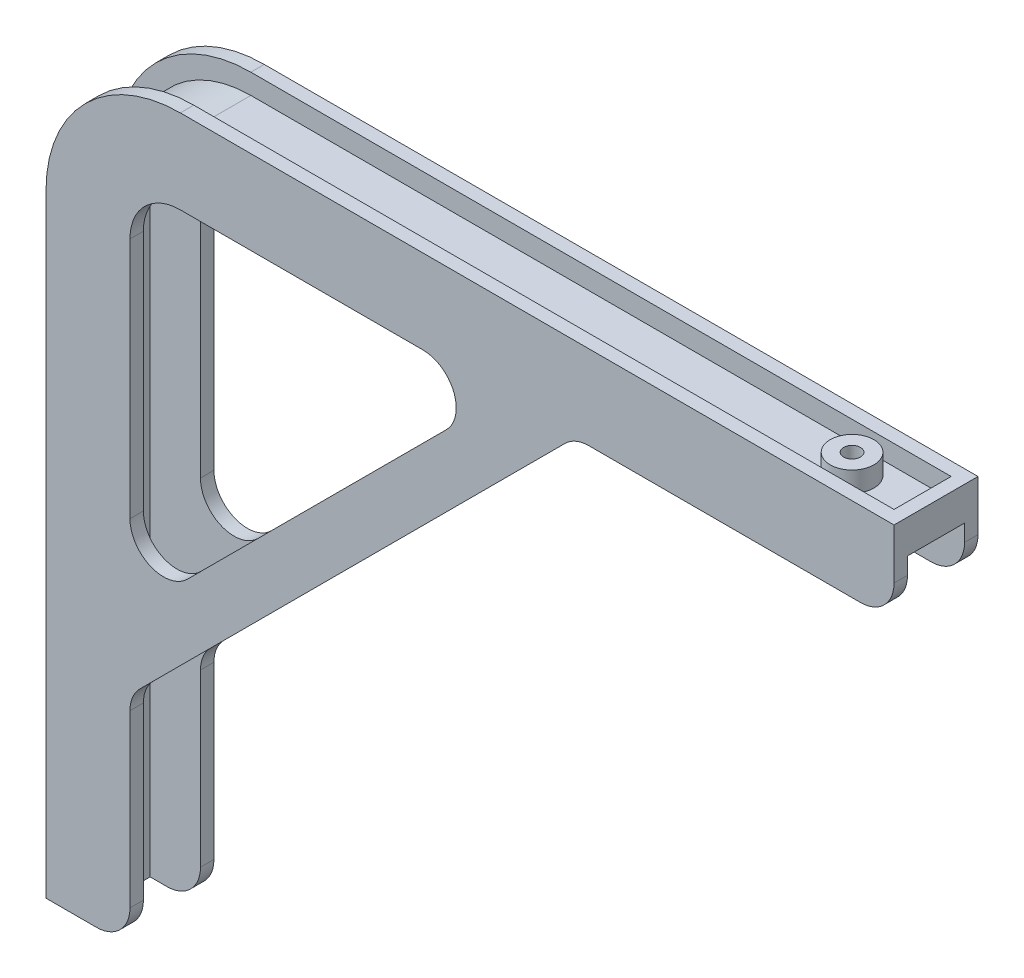
from build123d import *

# Parameters (mm, degrees)
EXTRUSION1_DEPTH        = 12.5
ESQUISSE2_R             = 3
ENL_V_MAT_EXTRU_1_DEPTH = 323.674371464
ESQUISSE3_R             = 2.5
ENL_V_MAT_EXTRU_2_DEPTH = 331.255582845
COQUE1_T                = -4
EXTRUSION2_DEPTH        = 4


with BuildPart() as part:
    # Esquisse1 → Extrusion1 (new, symmetric)
    with BuildSketch(Plane.XY):
        with BuildLine():
            Line((0, 0), (-212.5, 0))
            ThreePointArc((-212.5, 0), (-233.713203436, -8.786796564), (-242.5, -30))
            Line((-242.5, -30), (-242.5, -212.5))
            Line((-242.5, -212.5), (-252.5, -212.5))
            Line((-252.5, -212.5), (-252.5, -30))
            ThreePointArc((-252.5, -30), (-240.784271247, -1.715728753), (-212.5, 10))
            Line((-212.5, 10), (0, 10))
            Line((0, 10), (0, 0))
        make_face()
    extrude(amount=EXTRUSION1_DEPTH, both=True)

    # Esquisse2 → Enlèv. mat.-Extru.1 (cut, through all)
    with BuildSketch(Plane(origin=(-242.5, 0, 0), x_dir=(0, 0, -1), z_dir=(1, 0, 0))):
        with Locations(Location((0, -50, 0), (0, 0, 90))):
            Circle(ESQUISSE2_R)
        with Locations(Location((0, -175, 0), (0, 0, 90))):
            Circle(ESQUISSE2_R)
    extrude(amount=-ENL_V_MAT_EXTRU_1_DEPTH, mode=Mode.SUBTRACT)

    # Esquisse3 → Enlèv. mat.-Extru.2 (cut, through all)
    with BuildSketch(Plane.XZ):
        with Locations((-25, 0)):
            Circle(ESQUISSE3_R)
    extrude(amount=-ENL_V_MAT_EXTRU_2_DEPTH, mode=Mode.SUBTRACT)

    # Coque1
    coque1_openings = [part.faces().sort_by_distance(p)[0] for p in [
        (-252.5, -121.359810516, 0),
        (-240.784271247, -1.715728753, 0),
        (-106.551413319, 10, 0),
    ]]
    offset(amount=COQUE1_T, openings=coque1_openings, kind=Kind.INTERSECTION)

    # Esquisse4 → Extrusion2 (add)
    with BuildSketch(Plane.XY.offset(12.5)):
        with BuildLine():
            Line((-212.5, 0), (0, 0))
            Line((0, 0), (0, -5))
            ThreePointArc((0, -5), (-2.928932188, -12.071067812), (-10, -15))
            Line((-10, -15), (-90.857864376, -15))
            ThreePointArc((-90.857864376, -15), (-94.6846987, -15.761204675), (-97.928932188, -17.928932188))
            Line((-97.928932188, -17.928932188), (-224.571067812, -144.571067812))
            ThreePointArc((-224.571067812, -144.571067812), (-226.738795325, -147.8153013), (-227.5, -151.642135624))
            Line((-227.5, -151.642135624), (-227.5, -202.5))
            ThreePointArc((-227.5, -202.5), (-230.428932188, -209.571067812), (-237.5, -212.5))
            Line((-237.5, -212.5), (-242.5, -212.5))
            Line((-242.5, -212.5), (-242.5, -30))
            ThreePointArc((-242.5, -30), (-233.713203436, -8.786796564), (-212.5, 0))
        make_face()
        with BuildLine():
            Line((-212.5, -15), (-140.355339059, -15))
            ThreePointArc((-140.355339059, -15), (-131.116543734, -21.173165676), (-133.284271247, -32.071067812))
            Line((-133.284271247, -32.071067812), (-210.428932188, -109.215728753))
            ThreePointArc((-210.428932188, -109.215728753), (-221.326834324, -111.383456266), (-227.5, -102.144660941))
            Line((-227.5, -102.144660941), (-227.5, -30))
            ThreePointArc((-227.5, -30), (-223.106601718, -19.393398282), (-212.5, -15))
        make_face(mode=Mode.SUBTRACT)
    extrusion2 = extrude(amount=-EXTRUSION2_DEPTH)

    # Symétrie1: Extrusion2 across plane
    add(extrusion2.mirror(Plane.XY))


solid = part.part
